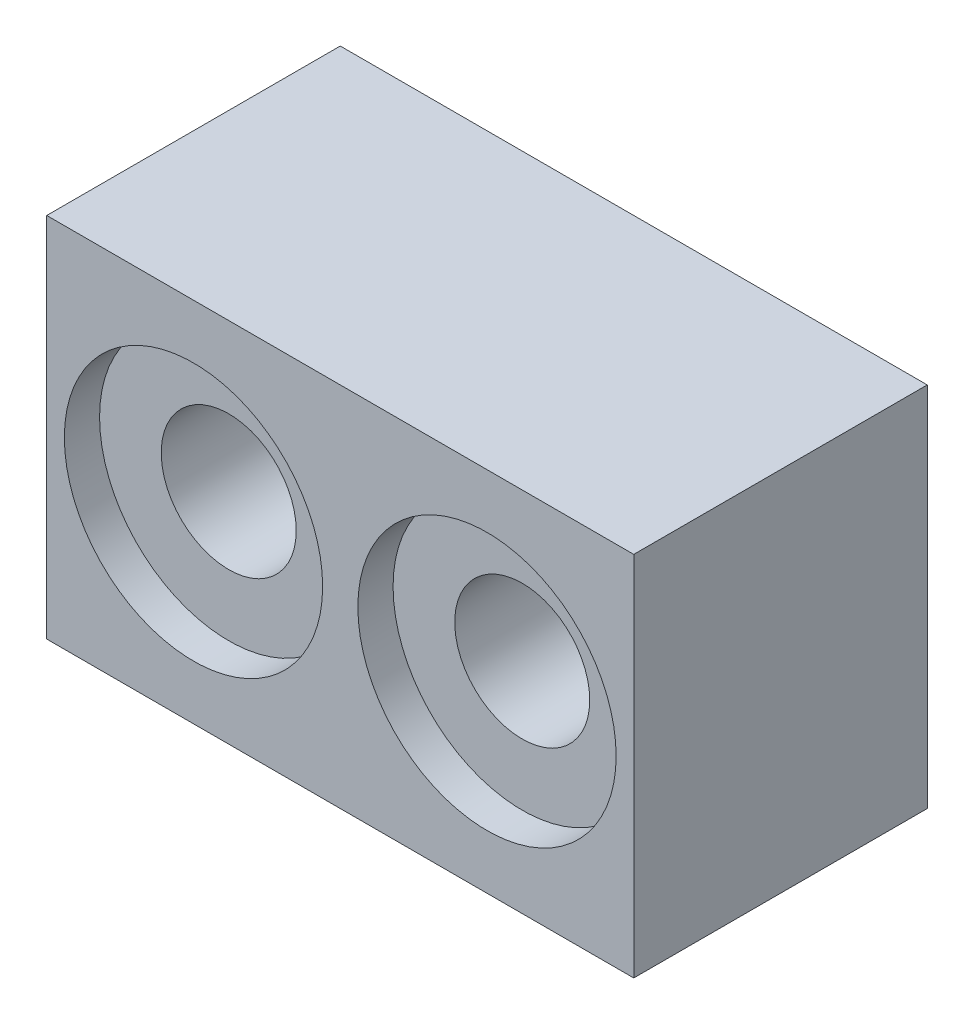
from build123d import *

# Parameters (mm, degrees)
SKETCH1_W           = 12.7
SKETCH1_H           = 7.9375
BOSS_EXTRUDE1_DEPTH = 6.35
SKETCH2_R           = 2.794
CUT_EXTRUDE1_DEPTH  = 0.762
SKETCH3_R           = 1.4605
CUT_EXTRUDE2_DEPTH  = 16.984982022


with BuildPart() as part:
    # Sketch1 → Boss-Extrude1 (new body)
    with BuildSketch(Plane.XY):
        with Locations((6.35, 3.96875)):
            Rectangle(SKETCH1_W, SKETCH1_H)
    extrude(amount=BOSS_EXTRUDE1_DEPTH)

    # Sketch2 → Cut-Extrude1 (cut)
    with BuildSketch(Plane.XY.offset(6.35)):
        with Locations((3.175, 3.96875)):
            Circle(SKETCH2_R)
        with Locations((9.525, 3.96875)):
            Circle(SKETCH2_R)
    extrude(amount=-CUT_EXTRUDE1_DEPTH, mode=Mode.SUBTRACT)

    # Sketch3 → Cut-Extrude2 (cut, through all)
    with BuildSketch(Plane.XY.offset(5.588)):
        with Locations((3.175, 3.96875)):
            Circle(SKETCH3_R)
        with Locations((9.525, 3.96875)):
            Circle(SKETCH3_R)
    extrude(amount=-CUT_EXTRUDE2_DEPTH, mode=Mode.SUBTRACT)


solid = part.part
